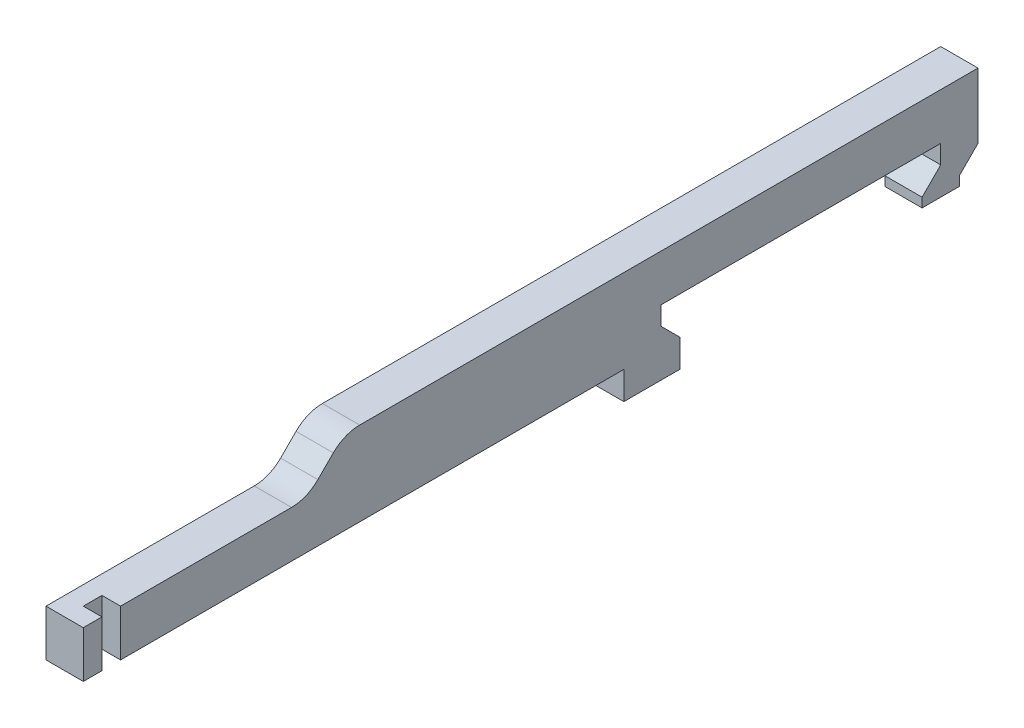
from build123d import *

# Parameters (mm, degrees)
SKETCH_1_W          = 12
SKETCH_1_H          = 2.5
EXTRUDE_1_DEPTH     = 2
FILLET_1_R          = 2
SKETCH_3_W          = 1
SKETCH_3_H          = 1
CUT_EXTRUDE_1_DEPTH = 49.207883173


with BuildPart() as part:
    # Эскиз1 → Бобышка-Вытянуть1 (new body)
    with BuildSketch(Plane(origin=(0, 0, 0), x_dir=(0, 0, -1), z_dir=(1, 0, 0))):
        Polygon((48, 1), (48, 4.5), (29, 4.5), (14, 4.5), (12, 2.5), (12, 0), (29, 0), (29, -1.5), (32, -1.5), (32, 0), (31, 1), (31, 2), (46, 2), (46, 1), (45, 0), (45, -0.5), (47, -0.5), (47, 0), align=None)
        with Locations((6, 1.25)):
            Rectangle(SKETCH_1_W, SKETCH_1_H)
    extrude(amount=EXTRUDE_1_DEPTH)

    # Скругление1
    fillet_1_edges = [part.edges().sort_by_distance(p)[0] for p in [
        (1, 2.5, -12),
        (1, 4.5, -14),
    ]]
    fillet(fillet_1_edges, radius=FILLET_1_R)

    # Эскиз3 → Вырез-Вытянуть1 (cut, through all)
    with BuildSketch(Plane(origin=(0, 2.5, 0), x_dir=(1, 0, 0), z_dir=(0, 1, 0))):
        with Locations((1.5, 1.5)):
            Rectangle(SKETCH_3_W, SKETCH_3_H)
    extrude(amount=-CUT_EXTRUDE_1_DEPTH, mode=Mode.SUBTRACT)


solid = part.part
